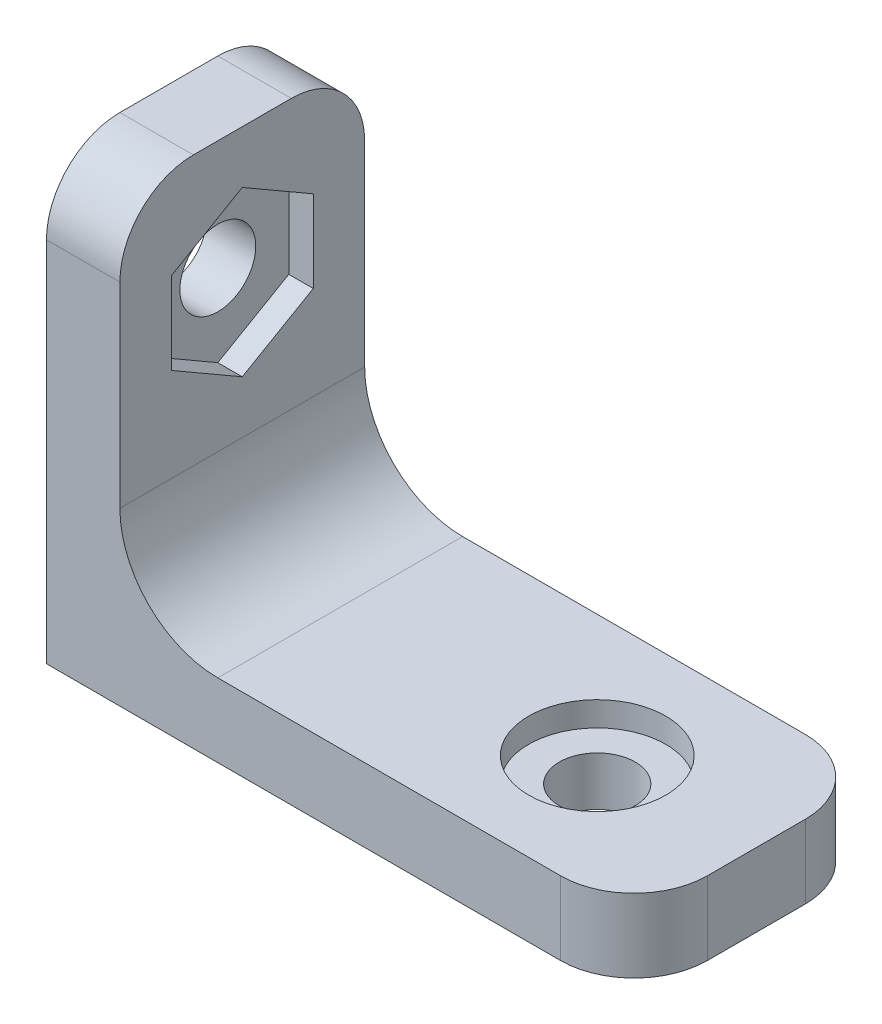
from build123d import *

# Parameters (mm, degrees)
CROQUIS1_W              = 24
CROQUIS1_H              = 10
CROQUIS1_R              = 1.55
SALIENTE_EXTRUIR1_DEPTH = 3
CROQUIS2_W              = 3
CROQUIS2_H              = 10
SALIENTE_EXTRUIR2_DEPTH = 15
CROQUIS3_R              = 1.55
CORTAR_EXTRUIR1_DEPTH   = 3
CROQUIS4_R              = 2.8
CORTAR_EXTRUIR2_DEPTH   = 1
CORTAR_EXTRUIR3_DEPTH   = 1
REDONDEO1_R             = 3
REDONDEO2_R             = 4


with BuildPart() as part:
    # Croquis1 → Saliente-Extruir1 (new body)
    with BuildSketch(Plane(origin=(0, 0, 0), x_dir=(1, 0, 0), z_dir=(0, 1, 0))):
        with Locations((12, 5)):
            Rectangle(CROQUIS1_W, CROQUIS1_H)
        with Locations(Location((17.5, 5, 0), (0, 0, 270))):
            Circle(CROQUIS1_R, mode=Mode.SUBTRACT)
    extrude(amount=SALIENTE_EXTRUIR1_DEPTH)

    # Croquis2 → Saliente-Extruir2 (add)
    with BuildSketch(Plane(origin=(0, 3, 0), x_dir=(1, 0, 0), z_dir=(0, 1, 0))):
        with Locations((1.5, 5)):
            Rectangle(CROQUIS2_W, CROQUIS2_H)
    extrude(amount=SALIENTE_EXTRUIR2_DEPTH)

    # Croquis3 → Cortar-Extruir1 (cut)
    with BuildSketch(Plane.ZY):
        with Locations((-5, 12.5)):
            Circle(CROQUIS3_R)
    extrude(amount=-CORTAR_EXTRUIR1_DEPTH, mode=Mode.SUBTRACT)

    # Croquis4 → Cortar-Extruir2 (cut)
    with BuildSketch(Plane(origin=(0, 3, 0), x_dir=(1, 0, 0), z_dir=(0, 1, 0))):
        with Locations(Location((17.5, 5, 0), (0, 0, 270))):
            Circle(CROQUIS4_R)
    extrude(amount=-CORTAR_EXTRUIR2_DEPTH, mode=Mode.SUBTRACT)

    # Croquis5 → Cortar-Extruir3 (cut)
    with BuildSketch(Plane(origin=(3, 0, 0), x_dir=(0, 0, -1), z_dir=(1, 0, 0))):
        Polygon((7.9, 14.174315781), (5, 15.848631561), (2.1, 14.174315781), (2.1, 10.825684219), (5, 9.151368439), (7.9, 10.825684219), align=None)
    extrude(amount=-CORTAR_EXTRUIR3_DEPTH, mode=Mode.SUBTRACT)

    # Redondeo1
    redondeo1_edges = [part.edges().sort_by_distance(p)[0] for p in [
        (1.5, 18, 0),
        (1.5, 18, -10),
        (24, 1.5, -10),
        (24, 1.5, 0),
    ]]
    fillet(redondeo1_edges, radius=REDONDEO1_R)

    # Redondeo2
    redondeo2_edges = [part.edges().sort_by_distance(p)[0] for p in [
        (3, 3, -5),
    ]]
    fillet(redondeo2_edges, radius=REDONDEO2_R)


solid = part.part
